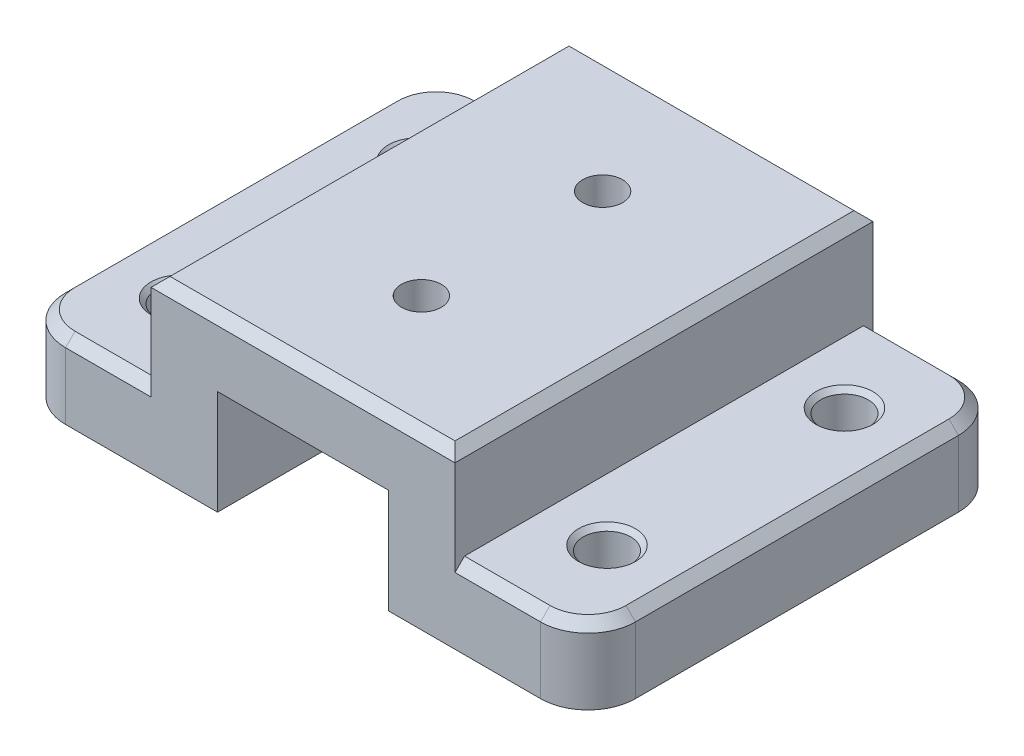
from build123d import *

# Parameters (mm, degrees)
EXTRUDE_1_DEPTH          = 22
FILLET_1_R               = 5
CHAMFER_1_SIZE           = 1
SKETCH_4_R               = 2.5
CUT_EXTRUDE_1_DEPTH      = 39.522720569
MIRROR_4_COPY_1_SKETCH_R = 2.5
MIRROR_4_COPY_1_DEPTH    = 39.522720569
CHAMFER_2_SIZE           = 0.5
HOLE_WIZARD_M5_1_D       = 4.2


with BuildPart() as part:
    # 草图1 → 凸台-拉伸1 (new, symmetric)
    with BuildSketch(Plane.XY):
        Polygon((-9, 0), (-30, 0), (-30, 8), (-16, 8), (-16, 18), (16, 18), (16, 8), (30, 8), (30, 0), (9, 0), (9, 11), (-9, 11), align=None)
    extrude(amount=EXTRUDE_1_DEPTH, both=True)

    # 圆角1
    fillet_1_edges = [part.edges().sort_by_distance(p)[0] for p in [
        (-30, 4, 22),
        (30, 4, 22),
        (30, 4, -22),
        (-30, 4, -22),
    ]]
    fillet(fillet_1_edges, radius=FILLET_1_R)

    # 倒角1
    chamfer_1_edges = [part.edges().sort_by_distance(p)[0] for p in [
        (-20.5, 8, 22),
        (0, 18, 22),
        (-16, 18, 0),
        (16, 18, 0),
        (0, 18, -22),
        (-30, 8, 0),
        (20.5, 8, -22),
        (-28.535533906, 8, 20.535533906),
        (-20.5, 8, -22),
        (-28.535533906, 8, -20.535533906),
        (30, 8, 0),
        (20.5, 8, 22),
        (28.535533906, 8, 20.535533906),
        (28.535533906, 8, -20.535533906),
    ]]
    chamfer(chamfer_1_edges, length=CHAMFER_1_SIZE)

    # 草图4 → 切除-拉伸1 (cut, through all)
    with BuildSketch(Plane(origin=(0, 8, 0), x_dir=(1, 0, 0), z_dir=(0, 1, 0))):
        with Locations(Location((22.5, 12.5, 0), (0, 0, 180))):
            Circle(SKETCH_4_R)
    cut_extrude_1 = extrude(amount=-CUT_EXTRUDE_1_DEPTH, mode=Mode.SUBTRACT)

    # 镜向3: 切除-拉伸1 across plane
    add(cut_extrude_1.mirror(Plane(origin=(0, 0, 0), x_dir=(0, 0, 1), z_dir=(1, 0, 0))), mode=Mode.SUBTRACT)

    # 镜向4: 切除-拉伸1 across plane
    add(cut_extrude_1.mirror(Plane.XY), mode=Mode.SUBTRACT)

    # 镜向4 copy 1 sketch → 镜向4 copy 1 (cut, through all)
    with BuildSketch(Plane(origin=(0, 8, 0), x_dir=(-1, 0, 0), z_dir=(0, 1, 0))):
        with Locations(Location((22.5, 12.5, 0), (0, 0, 180))):
            Circle(MIRROR_4_COPY_1_SKETCH_R)
    extrude(amount=-MIRROR_4_COPY_1_DEPTH, mode=Mode.SUBTRACT)

    # 倒角2
    chamfer_2_edges = [part.edges().sort_by_distance(p)[0] for p in [
        (25, 8, -12.5),
        (-25, 8, -12.5),
        (25, 8, 12.5),
        (-25, 8, 12.5),
    ]]
    chamfer(chamfer_2_edges, length=CHAMFER_2_SIZE)

    # M5 螺纹孔1 (through all)
    with Locations(Plane(origin=(0, 18, -9.540064206), x_dir=(1, 0, 0), z_dir=(0, 1, 0))):
        with Locations((0, 0)):
            hole_wizard_m5_1 = Hole(HOLE_WIZARD_M5_1_D / 2)

    # 镜向5: M5 螺纹孔1 across plane
    add(hole_wizard_m5_1.mirror(Plane.XY), mode=Mode.SUBTRACT)


solid = part.part
